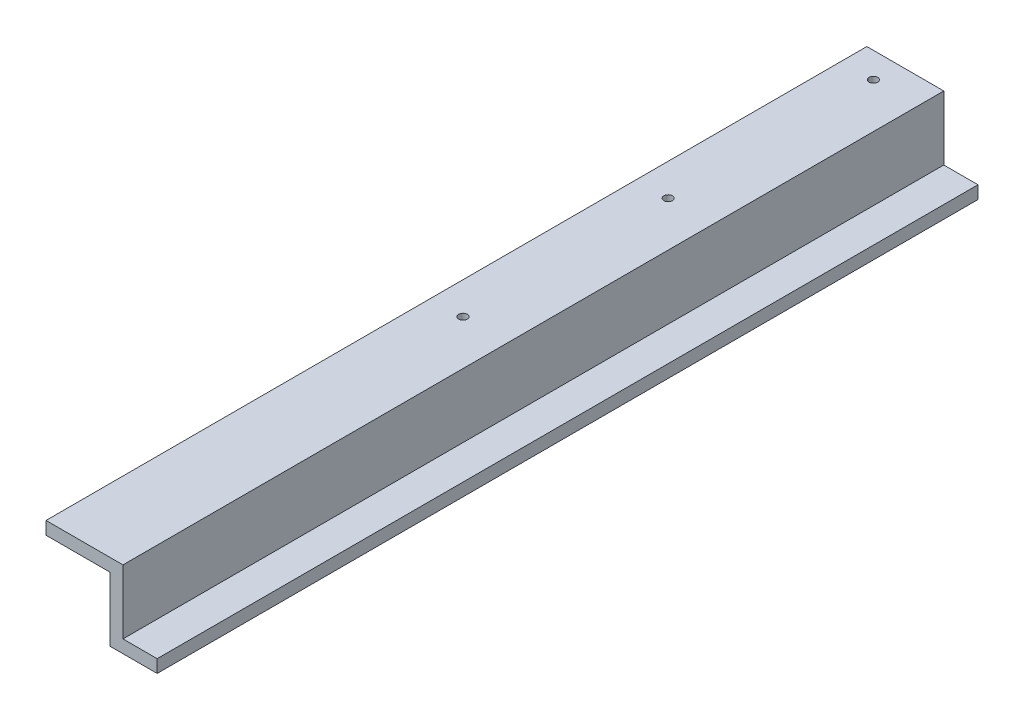
from build123d import *

# Parameters (mm, degrees)
BOSS_EXTRUDE1_DEPTH      = 152.4
BOSS_EXTRUDE1_DEPTH_BACK = 152.4
SKETCH6_R                = 1.5875
CUT_EXTRUDE1_DEPTH       = 4.7625


with BuildPart() as part:
    # Sketch3 → Boss-Extrude1 (new, two sides: drawn at the far end of the back side and taken through both)
    with BuildSketch(Plane.XY.offset(-BOSS_EXTRUDE1_DEPTH_BACK)):
        Polygon((15.08125, -9.525), (15.08125, -14.2875), (-2.38125, -14.2875), (-2.38125, 9.525), (-26.19375, 9.525), (-26.19375, 14.2875), (2.38125, 14.2875), (2.38125, -9.525), align=None)
    extrude(amount=BOSS_EXTRUDE1_DEPTH + BOSS_EXTRUDE1_DEPTH_BACK)

    # Sketch6 → Cut-Extrude1 (cut)
    with BuildSketch(Plane.XZ.offset(-9.525)):
        with Locations(Location((-14.2875, 9.463870403, 0), (0, 0, 270))):
            Circle(SKETCH6_R)
        with Locations(Location((-14.2875, -66.736129597, 0), (0, 0, 270))):
            Circle(SKETCH6_R)
        with Locations(Location((-14.2875, -142.936129597, 0), (0, 0, 270))):
            Circle(SKETCH6_R)
    extrude(amount=-CUT_EXTRUDE1_DEPTH, mode=Mode.SUBTRACT)


solid = part.part
